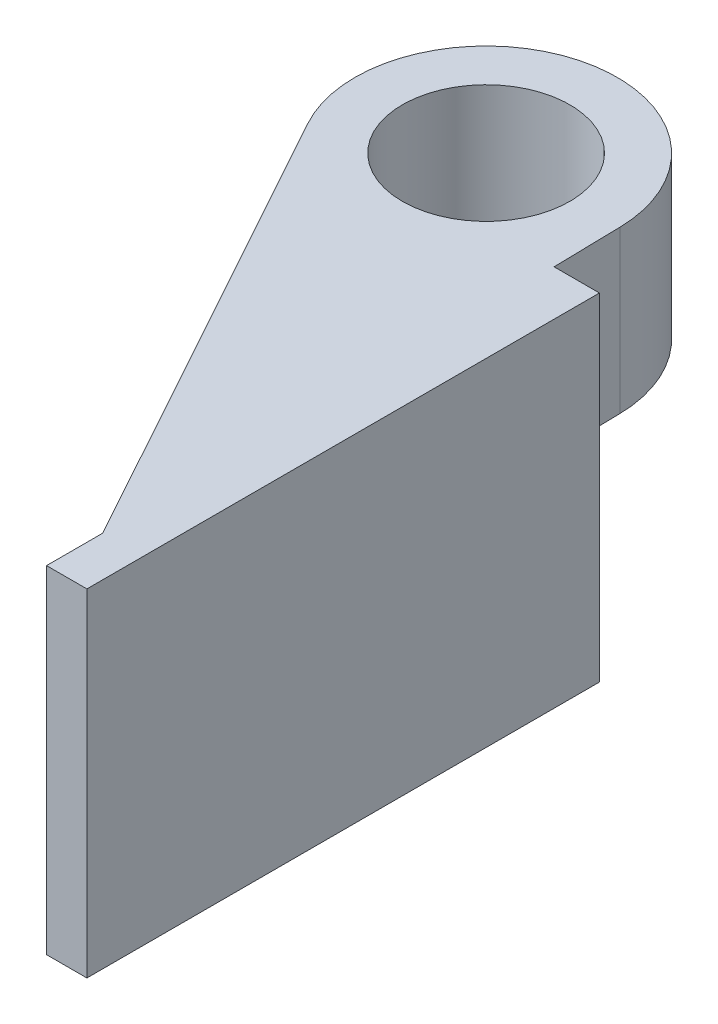
from build123d import *

# Parameters (mm, degrees)
BOSS_EXTRUDE1_DEPTH      = 4
BOSS_EXTRUDE2_DEPTH      = 4
BOSS_EXTRUDE2_DEPTH_BACK = 12.7
CUT_EXTRUDE1_START       = -8
SKETCH2_R                = 4.15
CUT_EXTRUDE1_DEPTH       = 5.95
SKETCH3_R                = 1.6
CUT_EXTRUDE2_DEPTH       = 32.16390509


with BuildPart() as part:
    # Sketch1 → Boss-Extrude1 (new, symmetric)
    with BuildSketch(Plane(origin=(0, 0, 0), x_dir=(1, 0, 0), z_dir=(0, 1, 0))):
        with BuildLine():
            ThreePointArc((6.498753649, 0.127283164), (-1.682323793, 6.278517871), (-5.691727336, -3.139146371))
            ThreePointArc((-5.691727336, -3.139146371), (1.620767152, -6.294689336), (6.5, 0))
            ThreePointArc((6.5, 0), (6.499688405, 0.063644633), (6.498753649, 0.127283164))
        make_face()
        with BuildLine():
            ThreePointArc((6.5, 0), (1.620767152, -6.294689336), (-5.691727336, -3.139146371))
            Line((-5.691727336, -3.139146371), (2.048950522, -17.174117205))
            ThreePointArc((2.048950522, -17.174117205), (4.906448368, -18.407206302), (6.813102435, -15.947435392))
            ThreePointArc((6.813102435, -15.947435392), (6.812980673, -15.922565028), (6.812615399, -15.897697048))
            Line((6.812615399, -15.897697048), (6.563875983, -3.197697048))
            Line((6.563875983, -3.197697048), (6.498753649, 0.127283164))
            ThreePointArc((6.498753649, 0.127283164), (6.499688405, 0.063644633), (6.5, 0))
        make_face()
        with BuildLine():
            ThreePointArc((6.812615399, -15.897697048), (6.812980673, -15.922565028), (6.813102435, -15.947435392))
            Line((6.813102435, -15.947435392), (6.813102435, -3.197697048))
            Line((6.813102435, -3.197697048), (6.563875983, -3.197697048))
            Line((6.563875983, -3.197697048), (6.812615399, -15.897697048))
        make_face()
        with BuildLine():
            ThreePointArc((6.813102435, -15.947435392), (4.906448368, -18.407206302), (2.048950522, -17.174117205))
            Line((2.048950522, -17.174117205), (6.813102435, -25.812215104))
            Line((6.813102435, -25.812215104), (6.813102435, -15.947435392))
        make_face()
    extrude(amount=BOSS_EXTRUDE1_DEPTH, both=True)

    # Sketch1<3> → Boss-Extrude2 (add, two sides: drawn at the far end of the back side and taken through both)
    with BuildSketch(Plane(origin=(0, 0, 0), x_dir=(1, 0, 0), z_dir=(0, 1, 0)).offset(-BOSS_EXTRUDE2_DEPTH_BACK)):
        Polygon((6.813102435, -15.947435392), (6.813102435, -25.812215104), (6.813102435, -28.597697048), (8.813098435, -28.597697048), (8.813098435, -3.197697048), (6.813102435, -3.197697048), align=None)
    extrude(amount=BOSS_EXTRUDE2_DEPTH + BOSS_EXTRUDE2_DEPTH_BACK)

    # Sketch2 → Cut-Extrude1 (cut)
    with BuildSketch(Plane.XZ.offset(4).offset(CUT_EXTRUDE1_START)):
        with Locations(Location((0, 0, 0), (0, 0, 90))):
            Circle(SKETCH2_R)
    extrude(amount=CUT_EXTRUDE1_DEPTH, mode=Mode.SUBTRACT)

    # Sketch3 → Cut-Extrude2 (cut, through all)
    with BuildSketch(Plane.XZ.offset(4)):
        with Locations(Location((0, 0, 0), (0, 0, 270))):
            Circle(SKETCH3_R)
    extrude(amount=-CUT_EXTRUDE2_DEPTH, mode=Mode.SUBTRACT)


solid = part.part
